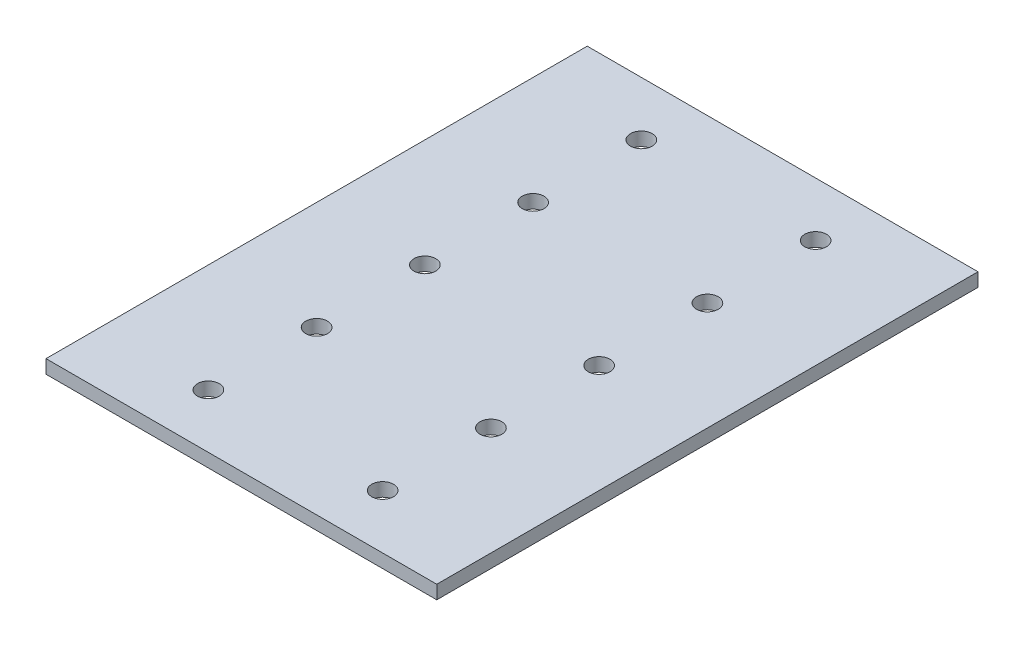
from build123d import *

# Parameters (mm, degrees)
SKETCH1_W           = 91.694
SKETCH1_H           = 127
BOSS_EXTRUDE1_DEPTH = 3.175
SKETCH2_R           = 2.5527
CUT_EXTRUDE1_DEPTH  = 3.175
LPATTERN1_COUNT     = 5
LPATTERN1_PITCH     = 25.4
SKETCH3_R           = 2.5527
CUT_EXTRUDE2_DEPTH  = 3.175
LPATTERN2_COUNT     = 5
LPATTERN2_PITCH     = 25.4


with BuildPart() as part:
    # Sketch1 → Boss-Extrude1 (new body)
    with BuildSketch(Plane(origin=(0, 0, 0), x_dir=(1, 0, 0), z_dir=(0, 1, 0))):
        with Locations((45.847, 63.5)):
            Rectangle(SKETCH1_W, SKETCH1_H)
    extrude(amount=BOSS_EXTRUDE1_DEPTH)

    # Sketch2 → Cut-Extrude1 (cut)
    with BuildSketch(Plane(origin=(0, 3.175, 0), x_dir=(1, 0, 0), z_dir=(0, 1, 0))):
        with Locations(Location((25.4, 12.7, 0), (0, 0, 270))):
            Circle(SKETCH2_R)
    cut_extrude1 = extrude(amount=-CUT_EXTRUDE1_DEPTH, mode=Mode.SUBTRACT)

    # LPattern1: Cut-Extrude1 ×5
    with Locations(*[(0, 0, -i * LPATTERN1_PITCH) for i in range(1, LPATTERN1_COUNT)]):
        add(cut_extrude1, mode=Mode.SUBTRACT)

    # Sketch3 → Cut-Extrude2 (cut)
    with BuildSketch(Plane(origin=(0, 3.175, 0), x_dir=(1, 0, 0), z_dir=(0, 1, 0))):
        with Locations(Location((66.294, 12.7, 0), (0, 0, 270))):
            Circle(SKETCH3_R)
    cut_extrude2 = extrude(amount=-CUT_EXTRUDE2_DEPTH, mode=Mode.SUBTRACT)

    # LPattern2: Cut-Extrude2 ×5
    with Locations(*[(0, 0, -i * LPATTERN2_PITCH) for i in range(1, LPATTERN2_COUNT)]):
        add(cut_extrude2, mode=Mode.SUBTRACT)


solid = part.part
